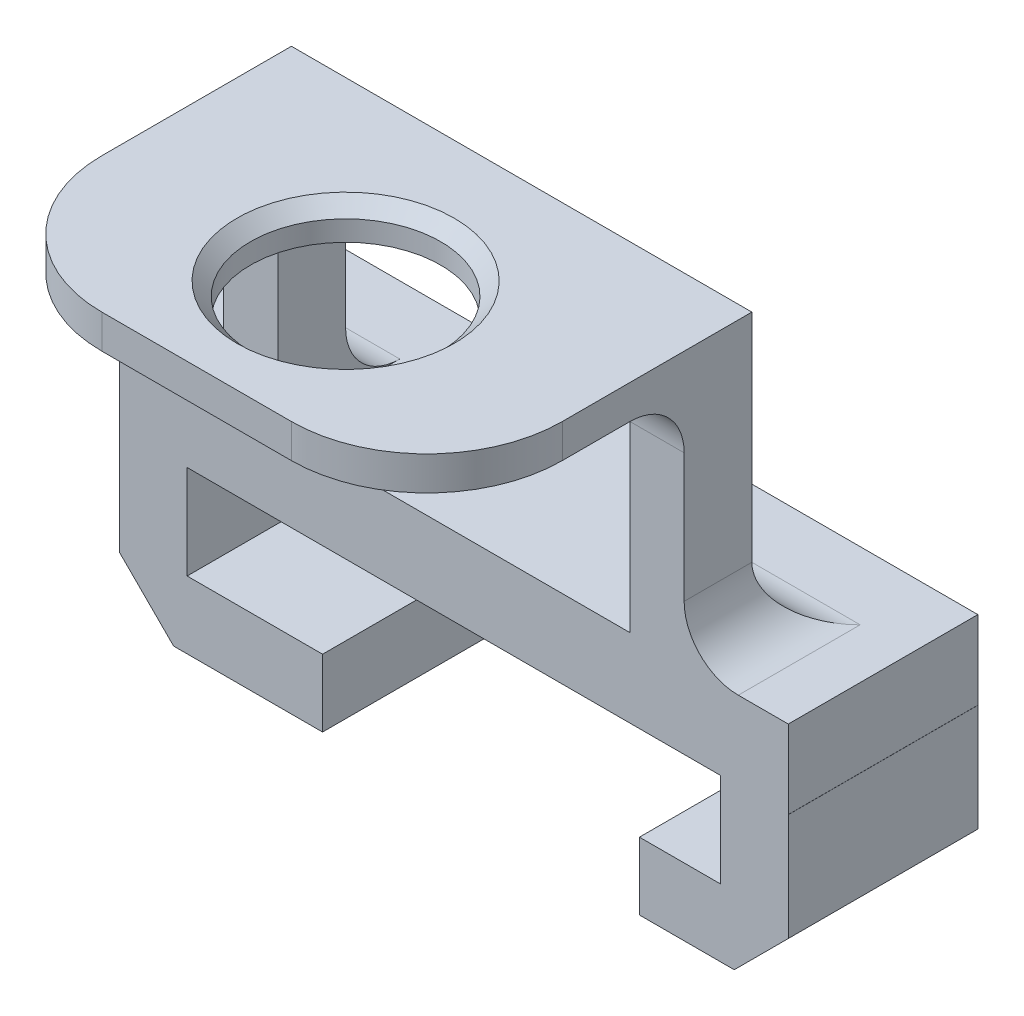
from build123d import *

# Parameters (mm, degrees)
SKETCH2_W           = 24.690663142
SKETCH2_H           = 2.894566797
BOSS_EXTRUDE2_DEPTH = 5
SKETCH2_2_W         = 24.690663142
SKETCH2_2_H         = 2.894566797
BOSS_EXTRUDE3_DEPTH = 2
SKETCH8_W           = 2.5
SKETCH8_H           = 7
BOSS_EXTRUDE4_DEPTH = 5.96
SKETCH10_W          = 7
SKETCH10_H          = 2.49
BOSS_EXTRUDE5_DEPTH = 3
SKETCH11_W          = 7
SKETCH11_H          = 2.49
BOSS_EXTRUDE6_DEPTH = 5
SKETCH12_W          = 17
SKETCH12_H          = 2.5
BOSS_EXTRUDE7_DEPTH = 10
CUT_EXTRUDE7_REACH  = 37.323
SKETCH14_W          = 13
SKETCH14_H          = 8.75
SKETCH16_W          = 17
SKETCH16_H          = 1.25
BOSS_EXTRUDE8_DEPTH = 9.5
CUT_EXTRUDE8_REACH  = 28.801
SKETCH17_R          = 3.51
FILLET7_R           = 2
FILLET8_R           = 5
FILLET9_R           = 5
CHAMFER1_SIZE       = 2
CHAMFER2_SIZE       = 2
FILLET11_R          = 2
FILLET12_R          = 2
FILLET13_R          = 2
FILLET14_R          = 2
FILLET16_R          = 2
CHAMFER3_SIZE       = 0.5


with BuildPart() as part:
    # Sketch2 → Boss-Extrude2 (new body)
    with BuildSketch(Plane.XY):
        with Locations((0, 20.897290887)):
            Rectangle(SKETCH2_W, SKETCH2_H)
    extrude(amount=BOSS_EXTRUDE2_DEPTH)

    # Sketch2<2> → Boss-Extrude3 (add)
    with BuildSketch(Plane.XY):
        with Locations((0, 20.897290887)):
            Rectangle(SKETCH2_2_W, SKETCH2_2_H)
    extrude(amount=-BOSS_EXTRUDE3_DEPTH)

    # Sketch8 → Boss-Extrude4 (add)
    with BuildSketch(Plane(origin=(0, 19.450007488, 0), x_dir=(-1, 0, 0), z_dir=(0, -1, 0))):
        with Locations((11.1, -1.5)):
            Rectangle(SKETCH8_W, SKETCH8_H)
        with Locations((-11.1, -1.5)):
            Rectangle(SKETCH8_W, SKETCH8_H)
    extrude(amount=BOSS_EXTRUDE4_DEPTH)

    # Sketch10 → Boss-Extrude5 (add)
    with BuildSketch(Plane.ZY.offset(-9.85)):
        with Locations((1.5, 14.735007488)):
            Rectangle(SKETCH10_W, SKETCH10_H)
    extrude(amount=BOSS_EXTRUDE5_DEPTH)

    # Sketch11 → Boss-Extrude6 (add)
    with BuildSketch(Plane(origin=(-9.85, 0, 0), x_dir=(0, 0, -1), z_dir=(1, 0, 0))):
        with Locations((-1.5, 14.735007488)):
            Rectangle(SKETCH11_W, SKETCH11_H)
    extrude(amount=BOSS_EXTRUDE6_DEPTH)

    # Sketch12 → Boss-Extrude7 (add)
    with BuildSketch(Plane(origin=(0, 22.344574285, 0), x_dir=(1, 0, 0), z_dir=(0, 1, 0))):
        with Locations((0, -3.75)):
            Rectangle(SKETCH12_W, SKETCH12_H)
    extrude(amount=BOSS_EXTRUDE7_DEPTH)

    # Sketch14 → Cut-Extrude7 (cut, up to next)
    with BuildSketch(Plane.XY.offset(5), mode=Mode.PRIVATE) as cut_extrude7_sk1:
        with Locations((0, 26.719574285)):
            Rectangle(SKETCH14_W, SKETCH14_H)
    cut_extrude7_tool1 = extrude(cut_extrude7_sk1.sketch, amount=-CUT_EXTRUDE7_REACH, mode=Mode.PRIVATE) & part.part
    add(cut_extrude7_tool1.solids().sort_by_distance((0, 26.719574, 5))[0], mode=Mode.SUBTRACT)

    # Sketch16 → Boss-Extrude8 (add)
    with BuildSketch(Plane.XY.offset(5)):
        with Locations((0, 31.719574285)):
            Rectangle(SKETCH16_W, SKETCH16_H)
    extrude(amount=BOSS_EXTRUDE8_DEPTH)

    # Sketch17 → Cut-Extrude8 (cut, up to next)
    with BuildSketch(Plane(origin=(0, 32.344574285, 0), x_dir=(1, 0, 0), z_dir=(0, 1, 0)), mode=Mode.PRIVATE) as cut_extrude8_sk1:
        with Locations((0, -9)):
            Circle(SKETCH17_R)
    cut_extrude8_tool1 = extrude(cut_extrude8_sk1.sketch, amount=-CUT_EXTRUDE8_REACH, mode=Mode.PRIVATE) & part.part
    add(cut_extrude8_tool1.solids().sort_by_distance((0, 32.344574, 9))[0], mode=Mode.SUBTRACT)

    # Fillet7
    fillet7_edges = [part.edges().sort_by_distance(p)[0] for p in [
        (7.5, 31.094574285, 5),
    ]]
    fillet(fillet7_edges, radius=FILLET7_R)

    # Fillet8
    fillet8_edges = [part.edges().sort_by_distance(p)[0] for p in [
        (8.5, 31.719574285, 14.5),
    ]]
    fillet(fillet8_edges, radius=FILLET8_R)

    # Fillet9
    fillet9_edges = [part.edges().sort_by_distance(p)[0] for p in [
        (-8.5, 31.719574285, 14.5),
    ]]
    fillet(fillet9_edges, radius=FILLET9_R)

    # Chamfer1
    chamfer1_edges = [part.edges().sort_by_distance(p)[0] for p in [
        (-12.35, 13.490007488, 1.5),
    ]]
    chamfer(chamfer1_edges, length=CHAMFER1_SIZE)

    # Chamfer2
    chamfer2_edges = [part.edges().sort_by_distance(p)[0] for p in [
        (12.35, 13.490007488, 1.5),
    ]]
    chamfer(chamfer2_edges, length=CHAMFER2_SIZE)

    # Fillet11
    fillet11_edges = [part.edges().sort_by_distance(p)[0] for p in [
        (-8.5, 22.344574285, 3.75),
    ]]
    fillet(fillet11_edges, radius=FILLET11_R)

    # Fillet12
    fillet12_edges = [part.edges().sort_by_distance(p)[0] for p in [
        (8.5, 22.344574285, 3.75),
    ]]
    fillet(fillet12_edges, radius=FILLET12_R)

    # Fillet13
    fillet13_edges = [part.edges().sort_by_distance(p)[0] for p in [
        (8.5, 22.344574285, 2.5),
    ]]
    fillet(fillet13_edges, radius=FILLET13_R)

    # Fillet14
    fillet14_edges = [part.edges().sort_by_distance(p)[0] for p in [
        (-8.5, 22.344574285, 2.5),
    ]]
    fillet(fillet14_edges, radius=FILLET14_R)

    # Fillet16
    fillet16_edges = [part.edges().sort_by_distance(p)[0] for p in [
        (-7.5, 31.094574285, 5),
    ]]
    fillet(fillet16_edges, radius=FILLET16_R)

    # Chamfer3
    chamfer3_edges = [part.edges().sort_by_distance(p)[0] for p in [
        (-3.51, 32.344574285, 9),
    ]]
    chamfer(chamfer3_edges, length=CHAMFER3_SIZE)


solid = part.part
